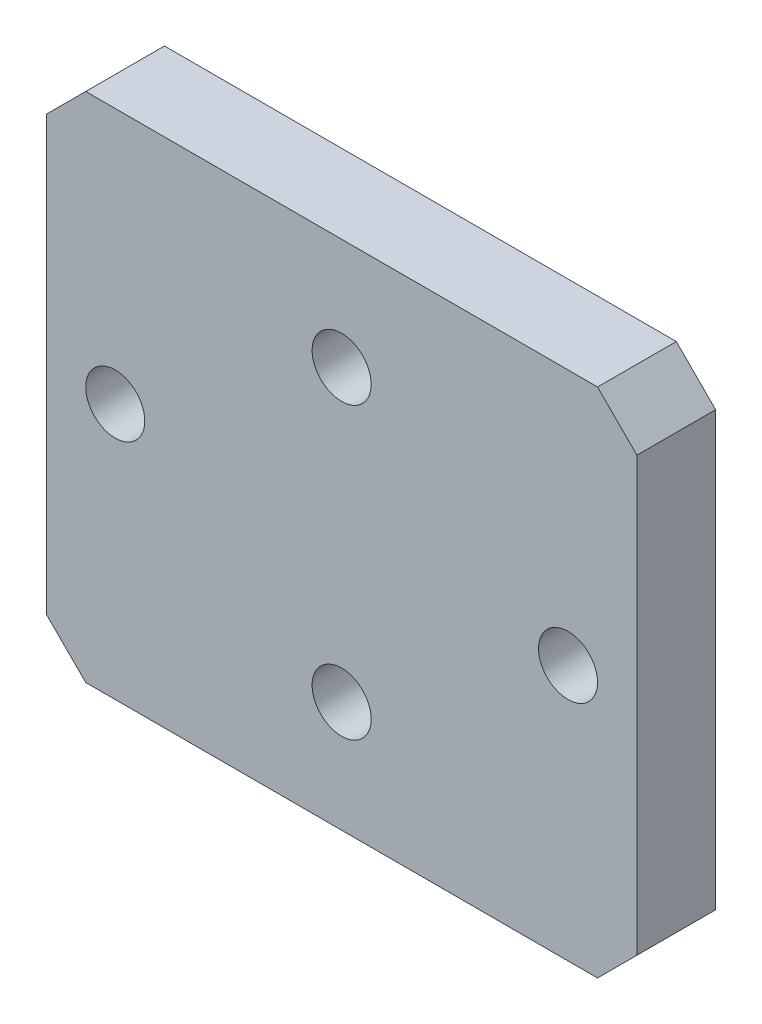
from build123d import *

# Parameters (mm, degrees)
SKETCH1_R           = 1.5
BOSS_EXTRUDE1_DEPTH = 4


with BuildPart() as part:
    # Sketch1 → Boss-Extrude1 (new body)
    with BuildSketch(Plane.XY):
        Polygon((0, 24), (2, 26), (28, 26), (30, 24), (30, 2), (28, 0), (2, 0), (0, 2), align=None)
        with Locations((3.5, 13)):
            Circle(SKETCH1_R, mode=Mode.SUBTRACT)
        with Locations((26.5, 13)):
            Circle(SKETCH1_R, mode=Mode.SUBTRACT)
        with Locations((15, 20.365)):
            Circle(SKETCH1_R, mode=Mode.SUBTRACT)
        with Locations((15, 5.635)):
            Circle(SKETCH1_R, mode=Mode.SUBTRACT)
    extrude(amount=BOSS_EXTRUDE1_DEPTH)


solid = part.part
